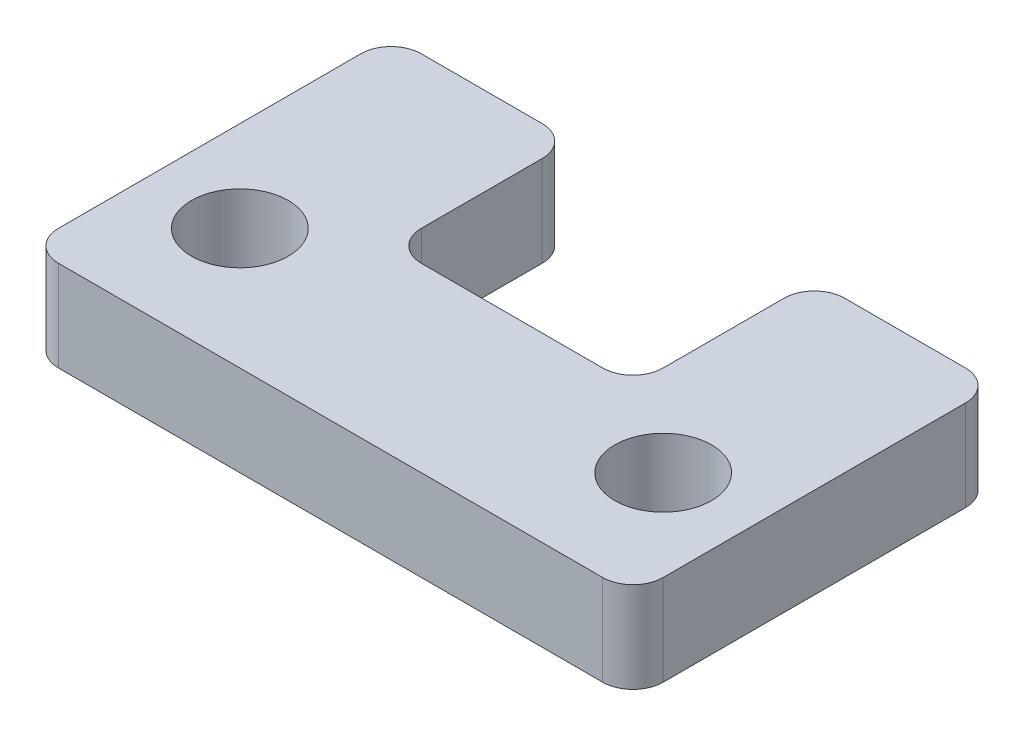
from build123d import *

# Parameters (mm, degrees)
SKETCH_1_R      = 1.6
EXTRUDE_1_DEPTH = 3
FILLET_1_R      = 1


with BuildPart() as part:
    # 草图1 → 凸台-拉伸1 (new body)
    with BuildSketch(Plane(origin=(0, 0, 0), x_dir=(1, 0, 0), z_dir=(0, 1, 0))):
        Polygon((-10, 0), (10, 0), (10, 12), (4, 12), (4, 6), (-4, 6), (-4, 12), (-10, 12), align=None)
        with Locations(Location((7, 4, 0), (0, 0, 270))):
            Circle(SKETCH_1_R, mode=Mode.SUBTRACT)
        with Locations(Location((-7, 4, 0), (0, 0, 90))):
            Circle(SKETCH_1_R, mode=Mode.SUBTRACT)
    extrude(amount=EXTRUDE_1_DEPTH)

    # 圆角1
    fillet_1_edges = [part.edges().sort_by_distance(p)[0] for p in [
        (-4, 1.5, -12),
        (-4, 1.5, -6),
        (4, 1.5, -6),
        (4, 1.5, -12),
        (10, 1.5, -12),
        (10, 1.5, 0),
        (-10, 1.5, 0),
        (-10, 1.5, -12),
    ]]
    fillet(fillet_1_edges, radius=FILLET_1_R)


solid = part.part
